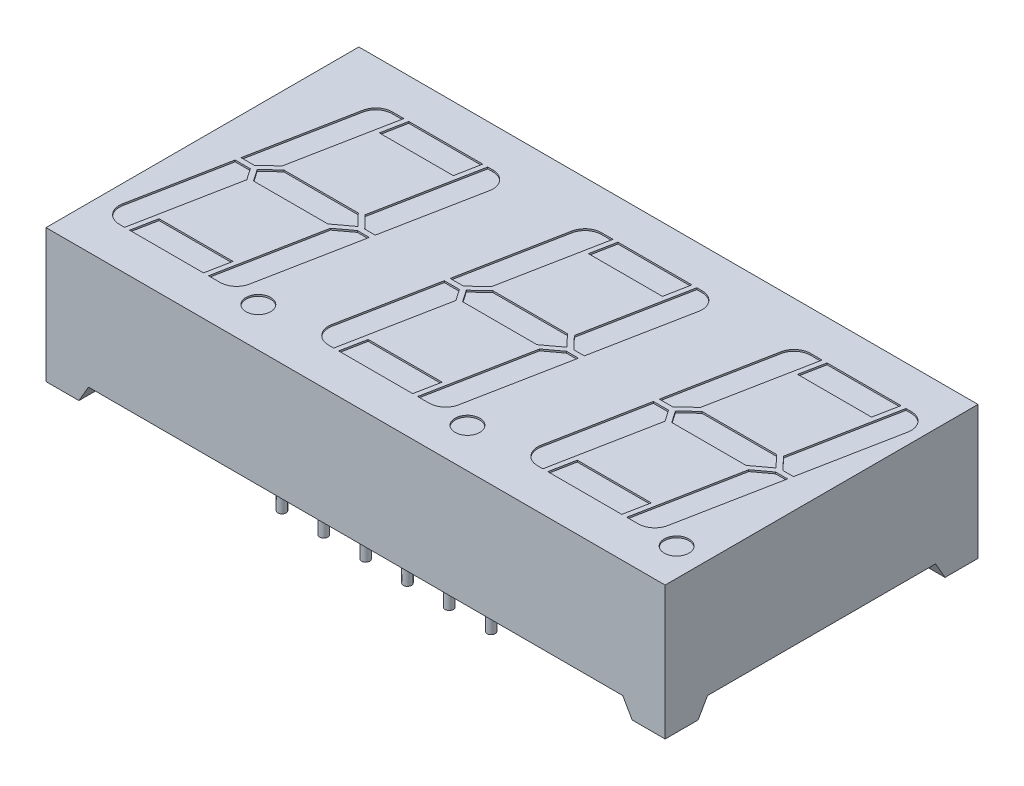
from build123d import *

# Parameters (mm, degrees)
SKETCH_1_W             = 37.6
SKETCH_1_H             = 19
EXTRUDE_1_DEPTH        = 8.1
SKETCH_3_R             = 0.75
CUT_EXTRUDE_1_DEPTH    = 0.1
PATTERN_LINEAR_1_COUNT = 3
PATTERN_LINEAR_1_PITCH = 12.7
CUT_EXTRUDE_4_DEPTH    = 28.929375217
CUT_EXTRUDE_5_DEPTH    = 40.618430055
EXTRUDE_3_DEPTH        = 2.5
EXTRUDE_3_DEPTH_BACK   = 1
SKETCH_7_R             = 0.25


with BuildPart() as part:
    # Эскиз1 → Бобышка-Вытянуть1 (new body)
    with BuildSketch(Plane(origin=(0, 0, 0), x_dir=(1, 0, 0), z_dir=(0, 1, 0))):
        Rectangle(SKETCH_1_W, SKETCH_1_H)
    extrude(amount=EXTRUDE_1_DEPTH)

    # Эскиз3 → Вырез-Вытянуть1 (cut)
    with BuildSketch(Plane(origin=(0, 8.1, 0), x_dir=(1, 0, 0), z_dir=(0, 1, 0))):
        with Locations(Location((-8.304984536, -7.1, 0), (0, 0, 270))):
            Circle(SKETCH_3_R)
        with BuildLine():
            Line((-16.613732692, -0.2), (-15.694010352, -0.2))
            Line((-15.694010352, -0.2), (-15.219253427, -0.887312434))
            Line((-15.219253427, -0.887312434), (-16.426812093, -7.1))
            Line((-16.426812093, -7.1), (-16.741799663, -7.1))
            ThreePointArc((-16.741799663, -7.1), (-17.513421017, -6.736082138), (-17.723428784, -5.909200972))
            Line((-17.723428784, -5.909200972), (-16.613732692, -0.2))
        make_face()
        Polygon((-15.447560185, -0.028936325), (-14.606711256, 0.75), (-10.084601751, 0.75), (-9.951753914, 0.611535824), (-9.389365278, 0.025371374), (-10.434703803, -0.75), (-14.949489793, -0.75), align=None)
        Polygon((-13.658315987, 5.6), (-13.366761329, 7.1), (-8.873187907, 7.1), (-9.164742565, 5.6), align=None)
        Polygon((-16.126812093, -7.1), (-15.835257435, -5.6), (-11.341684013, -5.6), (-11.633238671, -7.1), align=None)
        with BuildLine():
            Line((-8.405704285, 0.1), (-9.045218155, 0.1))
            Line((-9.045218155, 0.1), (-9.784090374, 0.870109138))
            Line((-9.784090374, 0.870109138), (-8.573187907, 7.1))
            Line((-8.573187907, 7.1), (-8.258200337, 7.1))
            ThreePointArc((-8.258200337, 7.1), (-7.486578983, 6.736082138), (-7.276571216, 5.909200972))
            Line((-7.276571216, 5.909200972), (-8.405704285, 0.1))
        make_face()
        with BuildLine():
            Line((-8.464015217, -0.2), (-9.087857218, -0.2))
            Line((-9.087857218, -0.2), (-9.189636199, -0.2))
            Line((-9.189636199, -0.2), (-10.127267632, -0.895480512))
            Line((-10.127267632, -0.895480512), (-11.333238671, -7.1))
            Line((-11.333238671, -7.1), (-10.629511556, -7.1))
            ThreePointArc((-10.629511556, -7.1), (-9.993429419, -6.871621354), (-9.647882436, -6.290799028))
            Line((-9.647882436, -6.290799028), (-8.464015217, -0.2))
        make_face()
        with BuildLine():
            Line((-16.555421761, 0.1), (-15.749822735, 0.1))
            Line((-15.749822735, 0.1), (-14.968967681, 0.823359864))
            Line((-14.968967681, 0.823359864), (-14.868695649, 0.916248759))
            Line((-14.868695649, 0.916248759), (-13.666761329, 7.1))
            Line((-13.666761329, 7.1), (-14.370488444, 7.1))
            ThreePointArc((-14.370488444, 7.1), (-15.006570581, 6.871621354), (-15.352117564, 6.290799028))
            Line((-15.352117564, 6.290799028), (-16.555421761, 0.1))
        make_face()
    cut_extrude_1 = extrude(amount=-CUT_EXTRUDE_1_DEPTH, mode=Mode.SUBTRACT)

    # Линейный массив1: Вырез-Вытянуть1 ×3
    with Locations(*[(i * PATTERN_LINEAR_1_PITCH, 0, 0) for i in range(1, PATTERN_LINEAR_1_COUNT)]):
        add(cut_extrude_1, mode=Mode.SUBTRACT)

    # Эскиз5 → Вырез-Вытянуть4 (cut, through all)
    with BuildSketch(Plane.XY.offset(9.5)):
        Polygon((-16.8, 0), (-16.222649731, 1), (16.222649731, 1), (16.8, 0), align=None)
    extrude(amount=-CUT_EXTRUDE_4_DEPTH, mode=Mode.SUBTRACT)

    # Эскиз6 → Вырез-Вытянуть5 (cut, through all)
    with BuildSketch(Plane(origin=(18.8, 0, 0), x_dir=(0, 0, -1), z_dir=(1, 0, 0))):
        Polygon((-7.5, 0), (-6.922649731, 1), (6.922649731, 1), (7.5, 0), align=None)
    extrude(amount=-CUT_EXTRUDE_5_DEPTH, mode=Mode.SUBTRACT)

    # Эскиз7 → Бобышка-Вытянуть3 (add, two sides: drawn at the far end of the back side and taken through both)
    with BuildSketch(Plane.XZ.offset(-1).offset(-EXTRUDE_3_DEPTH_BACK)):
        with Locations(Location((-1.27, -7.62, 0), (0, 0, 270))):
            Circle(SKETCH_7_R)
        with Locations(Location((-3.81, -7.62, 0), (0, 0, 270))):
            Circle(SKETCH_7_R)
        with Locations(Location((-6.35, -7.62, 0), (0, 0, 270))):
            Circle(SKETCH_7_R)
        with Locations((6.35, -7.62)):
            Circle(SKETCH_7_R)
        with Locations((3.81, -7.62)):
            Circle(SKETCH_7_R)
        with Locations((1.27, -7.62)):
            Circle(SKETCH_7_R)
        with Locations(Location((1.27, 7.62, 0), (0, 0, 270))):
            Circle(SKETCH_7_R)
        with Locations(Location((3.81, 7.62, 0), (0, 0, 270))):
            Circle(SKETCH_7_R)
        with Locations(Location((6.35, 7.62, 0), (0, 0, 270))):
            Circle(SKETCH_7_R)
        with Locations((-6.35, 7.62)):
            Circle(SKETCH_7_R)
        with Locations((-3.81, 7.62)):
            Circle(SKETCH_7_R)
        with Locations((-1.27, 7.62)):
            Circle(SKETCH_7_R)
    extrude(amount=EXTRUDE_3_DEPTH + EXTRUDE_3_DEPTH_BACK)


solid = part.part
